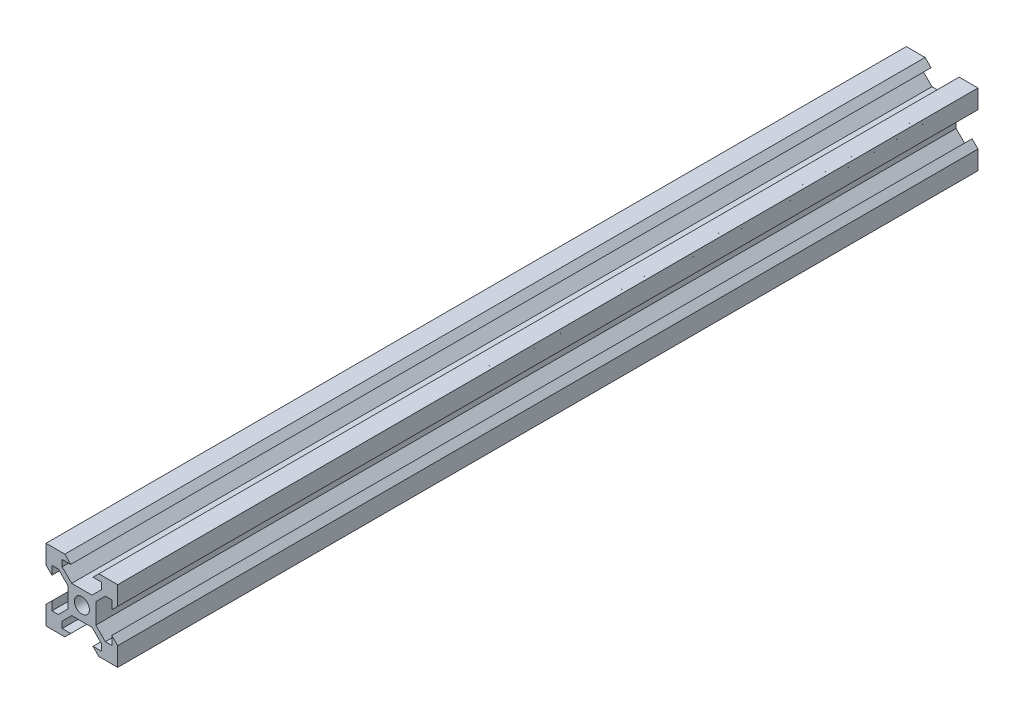
from build123d import *

# Parameters (mm, degrees)
SKETCH1_R           = 2.1
BOSS_EXTRUDE1_DEPTH = 120


with BuildPart() as part:
    # Sketch1 → Boss-Extrude1 (new, symmetric)
    with BuildSketch(Plane.XY):
        Polygon((2.834320347, 3.893970342), (5.5, 6.558849663), (5.5, 8.349069506), (3.1, 8.349069506), (4.75, 9.998574117), (10, 9.998574117), (10, 4.746997406), (8.35, 3.097492795), (8.350720674, 5.497492687), (6.560500912, 5.498030255), (3.894821259, 2.833150935), (3.894821259, -2.833150935), (6.560500912, -5.498030255), (8.350720674, -5.497492687), (8.35, -3.097492795), (10, -4.746997406), (10, -9.998574117), (4.75, -9.998574117), (3.1, -8.349069506), (5.5, -8.349069506), (5.5, -6.558849663), (2.834320347, -3.893970342), (-2.834320347, -3.893970342), (-5.5, -6.558849663), (-5.5, -8.349069506), (-3.1, -8.349069506), (-4.75, -9.998574117), (-10, -9.998574117), (-10, -4.746997406), (-8.35, -3.097492795), (-8.350720674, -5.497492687), (-6.560500912, -5.498030255), (-3.894821259, -2.833150935), (-3.894821259, 2.833150935), (-6.560500912, 5.498030255), (-8.350720674, 5.497492687), (-8.35, 3.097492795), (-10, 4.746997406), (-10, 9.998574117), (-4.75, 9.998574117), (-3.1, 8.349069506), (-5.5, 8.349069506), (-5.5, 6.558849663), (-2.834320347, 3.893970342), align=None)
        Circle(SKETCH1_R, mode=Mode.SUBTRACT)
    extrude(amount=BOSS_EXTRUDE1_DEPTH, both=True)


solid = part.part
